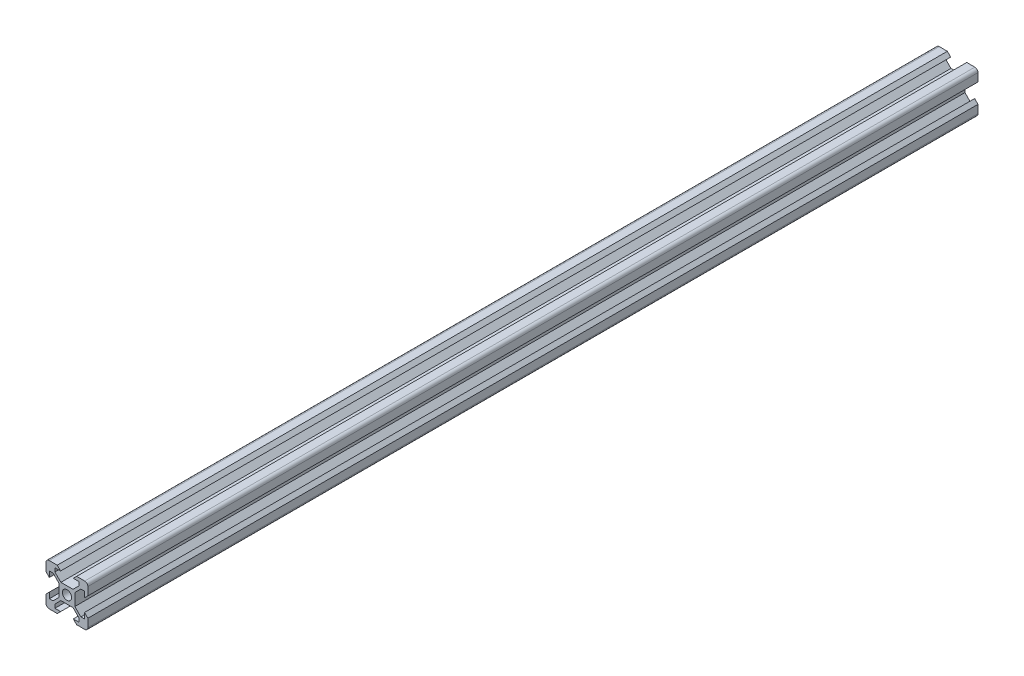
from build123d import *

# Parameters (mm, degrees)
SKETCH1_W           = 15.088
SKETCH1_H           = 15.088
SKETCH1_R           = 4.4
BOSS_EXTRUDE1_DEPTH = 425


with BuildPart() as part:
    # Sketch1 → Boss-Extrude1 (new, symmetric)
    # profile 1 of 5: a face of its own
    with BuildSketch(Plane.XY):
        with BuildLine():
            Line((-7.544, 7.544), (-5.784718328, 7.544))
            Line((-5.784718328, 7.544), (-11.512, 13.271281672))
            Line((-11.512, 13.271281672), (-11.512, 16.8))
            Line((-11.512, 16.8), (-6.051976926, 16.8))
            Line((-6.051976926, 16.8), (-9.251976926, 20))
            Line((-9.251976926, 20), (-17, 20))
            ThreePointArc((-17, 20), (-19.121320344, 19.121320344), (-20, 17))
            Line((-20, 17), (-20, 9.251976926))
            Line((-20, 9.251976926), (-16.8, 6.051976926))
            Line((-16.8, 6.051976926), (-16.8, 11.512))
            Line((-16.8, 11.512), (-13.271281672, 11.512))
            Line((-13.271281672, 11.512), (-7.544, 5.784718328))
            Line((-7.544, 5.784718328), (-7.544, 7.544))
        make_face()
    # profile 2 of 5: a face of its own
    with BuildSketch(Plane.XY):
        with BuildLine():
            Line((11.512, 13.271281672), (5.784718328, 7.544))
            Line((5.784718328, 7.544), (7.544, 7.544))
            Line((7.544, 7.544), (7.544, 5.784718328))
            Line((7.544, 5.784718328), (13.271281672, 11.512))
            Line((13.271281672, 11.512), (16.8, 11.512))
            Line((16.8, 11.512), (16.8, 6.051976926))
            Line((16.8, 6.051976926), (20, 9.251976926))
            Line((20, 9.251976926), (20, 17))
            ThreePointArc((20, 17), (19.121320344, 19.121320344), (17, 20))
            Line((17, 20), (9.251976926, 20))
            Line((9.251976926, 20), (6.051976926, 16.8))
            Line((6.051976926, 16.8), (11.512, 16.8))
            Line((11.512, 16.8), (11.512, 13.271281672))
        make_face()
    # profile 3 of 5: a face of its own
    with BuildSketch(Plane.XY):
        with BuildLine():
            Line((-7.544, -7.544), (-7.544, -5.784718328))
            Line((-7.544, -5.784718328), (-13.271281672, -11.512))
            Line((-13.271281672, -11.512), (-16.8, -11.512))
            Line((-16.8, -11.512), (-16.8, -6.051976926))
            Line((-16.8, -6.051976926), (-20, -9.251976926))
            Line((-20, -9.251976926), (-20, -17))
            ThreePointArc((-20, -17), (-19.121320344, -19.121320344), (-17, -20))
            Line((-17, -20), (-9.251976926, -20))
            Line((-9.251976926, -20), (-6.051976926, -16.8))
            Line((-6.051976926, -16.8), (-11.512, -16.8))
            Line((-11.512, -16.8), (-11.512, -13.271281672))
            Line((-11.512, -13.271281672), (-5.784718328, -7.544))
            Line((-5.784718328, -7.544), (-7.544, -7.544))
        make_face()
    # profile 4 of 5: a face of its own
    with BuildSketch(Plane.XY):
        with BuildLine():
            Line((13.271281672, -11.512), (7.544, -5.784718328))
            Line((7.544, -5.784718328), (7.544, -7.544))
            Line((7.544, -7.544), (5.784718328, -7.544))
            Line((5.784718328, -7.544), (11.512, -13.271281672))
            Line((11.512, -13.271281672), (11.512, -16.8))
            Line((11.512, -16.8), (6.051976926, -16.8))
            Line((6.051976926, -16.8), (9.251976926, -20))
            Line((9.251976926, -20), (17, -20))
            ThreePointArc((17, -20), (19.121320344, -19.121320344), (20, -17))
            Line((20, -17), (20, -9.251976926))
            Line((20, -9.251976926), (16.8, -6.051976926))
            Line((16.8, -6.051976926), (16.8, -11.512))
            Line((16.8, -11.512), (13.271281672, -11.512))
        make_face()
    # profile 5 of 5: a face of its own
    with BuildSketch(Plane.XY):
        Rectangle(SKETCH1_W, SKETCH1_H)
        Circle(SKETCH1_R, mode=Mode.SUBTRACT)
    extrude(amount=BOSS_EXTRUDE1_DEPTH, both=True)


solid = part.part
